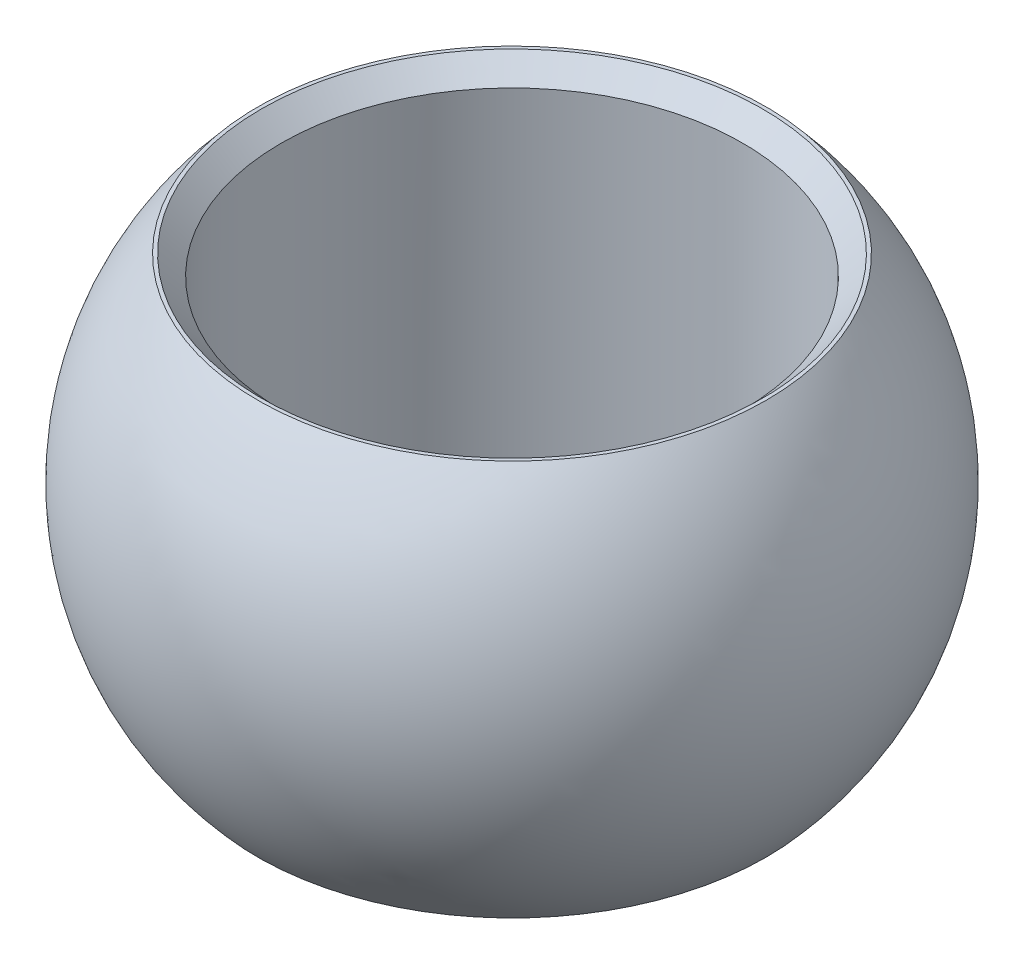
from build123d import *

# Parameters (mm, degrees)
CHAMFER1_SIZE = 1.5


with BuildPart() as part:
    # Sketch1 → Revolve1 (revolve)
    with BuildSketch(Plane.XY):
        with BuildLine():
            Line((17.5, 15), (17.5, -15))
            Line((17.5, -15), (19.270509831, -15))
            ThreePointArc((19.270509831, -15), (25, 0), (19.270509831, 15))
            Line((19.270509831, 15), (17.5, 15))
        make_face()
    revolve(axis=Axis((0, -493.111033268, 0), (0, 1, 0)))

    # Chamfer1
    chamfer1_edges = [part.edges().sort_by_distance(p)[0] for p in [
        (-17.5, 15, 0),
        (-17.5, -15, 0),
    ]]
    chamfer(chamfer1_edges, length=CHAMFER1_SIZE)


solid = part.part
